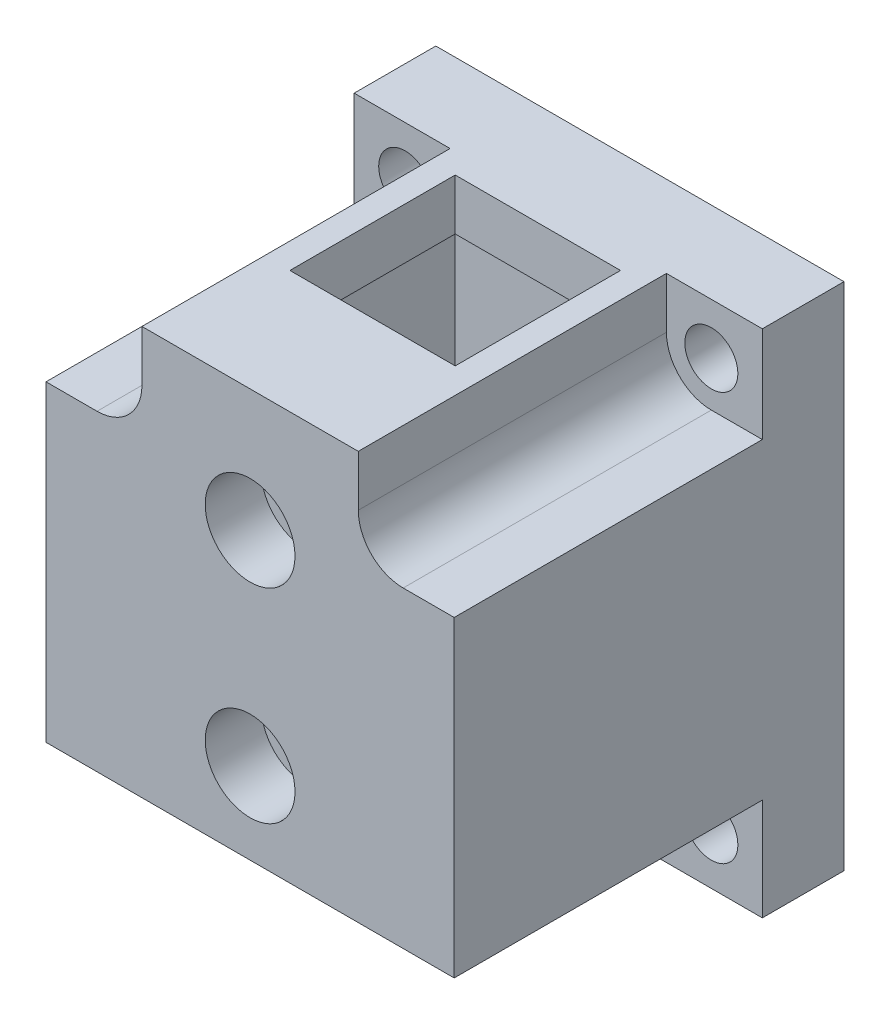
from build123d import *

# Parameters (mm, degrees)
SKETCH1_W           = 40
SKETCH1_H           = 40
BOSS_EXTRUDE1_DEPTH = 8
SKETCH6_W           = 40
SKETCH6_H           = 8
BOSS_EXTRUDE4_DEPTH = 10
BOSS_EXTRUDE2_DEPTH = 20.2
SKETCH3_W           = 40
SKETCH3_H           = 40
BOSS_EXTRUDE3_DEPTH = 10
SKETCH4_R           = 2.6
CUT_EXTRUDE1_DEPTH  = 69.258625829
SKETCH5_R           = 4.4
SKETCH5_R_2         = 2.6
CUT_EXTRUDE2_DEPTH  = 30.2
SKETCH5_3_R         = 4.4
SKETCH5_3_R_2       = 2.6
CUT_EXTRUDE3_DEPTH  = 5.5
CUT_EXTRUDE4_START  = -32.7
SKETCH5_4_R         = 4.4
SKETCH5_4_R_2       = 2.6
CUT_EXTRUDE4_DEPTH  = 5.5
SKETCH7_W           = 16.2
SKETCH7_H           = 16.2
CUT_EXTRUDE5_DEPTH  = 10
CHAMFER1_SIZE       = 0.5


with BuildPart() as part:
    # Sketch1 → Boss-Extrude1 (new body)
    with BuildSketch(Plane.XY):
        with Locations((20, 20)):
            Rectangle(SKETCH1_W, SKETCH1_H)
    extrude(amount=BOSS_EXTRUDE1_DEPTH)

    # Sketch6 → Boss-Extrude4 (add)
    with BuildSketch(Plane.XZ):
        with Locations((20, 4)):
            Rectangle(SKETCH6_W, SKETCH6_H)
    extrude(amount=BOSS_EXTRUDE4_DEPTH)

    # Sketch2 → Boss-Extrude2 (add)
    with BuildSketch(Plane.XY.offset(8)):
        Polygon((0, 40), (10, 40), (30, 40), (40, 40), (40, 0), (30.1, 0), (30.1, 35), (9.9, 35), (9.9, 0), (0, 0), align=None)
    extrude(amount=BOSS_EXTRUDE2_DEPTH)

    # Sketch3 → Boss-Extrude3 (add)
    with BuildSketch(Plane.XY.offset(28.2)):
        with Locations((20, 20)):
            Rectangle(SKETCH3_W, SKETCH3_H)
    extrude(amount=BOSS_EXTRUDE3_DEPTH)

    # Sketch4 → Cut-Extrude1 (cut, through all)
    with BuildSketch(Plane.XY.offset(38.2)):
        with Locations((35, 35)):
            Circle(SKETCH4_R)
        with Locations((35, -5)):
            Circle(SKETCH4_R)
        with Locations((5, 35)):
            Circle(SKETCH4_R)
        with Locations((5, -5)):
            Circle(SKETCH4_R)
        with Locations((20, 28)):
            Circle(SKETCH4_R)
        with Locations((20, 8)):
            Circle(SKETCH4_R)
    extrude(amount=-CUT_EXTRUDE1_DEPTH, mode=Mode.SUBTRACT)

    # Sketch5 → Cut-Extrude2 (cut)
    # profile 1 of 8: a face of its own
    with BuildSketch(Plane.XY.offset(38.2)):
        with Locations((5, 35)):
            Circle(SKETCH5_R)
        with Locations((5, 35)):
            Circle(SKETCH5_R_2, mode=Mode.SUBTRACT)
    # profile 2 of 8: a face of its own
    with BuildSketch(Plane.XY.offset(38.2)):
        with Locations((35, 35)):
            Circle(SKETCH5_R)
        with Locations((35, 35)):
            Circle(SKETCH5_R_2, mode=Mode.SUBTRACT)
    # profile 3 of 8: a face of its own
    with BuildSketch(Plane.XY.offset(38.2)):
        with Locations((35, -5)):
            Circle(SKETCH5_R)
    # profile 4 of 8: a face of its own
    with BuildSketch(Plane.XY.offset(38.2)):
        with Locations((5, -5)):
            Circle(SKETCH5_R)
    # profile 5 of 8: a face of its own
    with BuildSketch(Plane.XY.offset(38.2)):
        with BuildLine():
            ThreePointArc((5, 30.6), (1.888730163, 38.111269837), (9.4, 35))
            Line((9.4, 35), (9.4, 40))
            Line((9.4, 40), (0, 40))
            Line((0, 40), (0, 30.6))
            Line((0, 30.6), (5, 30.6))
        make_face()
    # profile 6 of 8: a face of its own
    with BuildSketch(Plane.XY.offset(38.2)):
        with BuildLine():
            Line((40, 40), (30.6, 40))
            Line((30.6, 40), (30.6, 35))
            ThreePointArc((30.6, 35), (35, 39.4), (39.4, 35))
            ThreePointArc((39.4, 35), (38.111269837, 31.888730163), (35, 30.6))
            Line((35, 30.6), (40, 30.6))
            Line((40, 30.6), (40, 40))
        make_face()
    # profile 7 of 8: a face of its own
    with BuildSketch(Plane.XY.offset(38.2)):
        with Locations((35, -5)):
            Circle(SKETCH5_R)
    # profile 8 of 8: a face of its own
    with BuildSketch(Plane.XY.offset(38.2)):
        with Locations((5, -5)):
            Circle(SKETCH5_R)
    extrude(amount=-CUT_EXTRUDE2_DEPTH, mode=Mode.SUBTRACT)

    # Sketch5<3> → Cut-Extrude3 (cut)
    # profile 1 of 2: a face of its own
    with BuildSketch(Plane.XY.offset(38.2)):
        with Locations((20, 28)):
            Circle(SKETCH5_3_R)
        with Locations((20, 28)):
            Circle(SKETCH5_3_R_2, mode=Mode.SUBTRACT)
    # profile 2 of 2: a face of its own
    with BuildSketch(Plane.XY.offset(38.2)):
        with Locations((20, 8)):
            Circle(SKETCH5_3_R)
        with Locations((20, 8)):
            Circle(SKETCH5_3_R_2, mode=Mode.SUBTRACT)
    extrude(amount=-CUT_EXTRUDE3_DEPTH, mode=Mode.SUBTRACT)

    # Sketch5<4> → Cut-Extrude4 (cut)
    # profile 1 of 2: a face of its own
    with BuildSketch(Plane.XY.offset(38.2).offset(CUT_EXTRUDE4_START)):
        with Locations((20, 28)):
            Circle(SKETCH5_4_R)
        with Locations(Location((20, 28, 0), (0, 0, 180))):
            Circle(SKETCH5_4_R_2, mode=Mode.SUBTRACT)
    # profile 2 of 2: a face of its own
    with BuildSketch(Plane.XY.offset(38.2).offset(CUT_EXTRUDE4_START)):
        with Locations((20, 8)):
            Circle(SKETCH5_4_R)
        with Locations(Location((20, 8, 0), (0, 0, 180))):
            Circle(SKETCH5_4_R_2, mode=Mode.SUBTRACT)
    extrude(amount=-CUT_EXTRUDE4_DEPTH, mode=Mode.SUBTRACT)

    # Sketch7 → Cut-Extrude5 (cut)
    with BuildSketch(Plane.XZ.offset(-35)):
        with Locations((20, 18.1)):
            Rectangle(SKETCH7_W, SKETCH7_H)
    extrude(amount=-CUT_EXTRUDE5_DEPTH, mode=Mode.SUBTRACT)

    # Chamfer1
    chamfer1_edges = [part.edges().sort_by_distance(p)[0] for p in [
        (9.9, 0, 18.1),
        (30.1, 0, 18.1),
        (20, 0, 28.2),
    ]]
    chamfer(chamfer1_edges, length=CHAMFER1_SIZE)


solid = part.part
